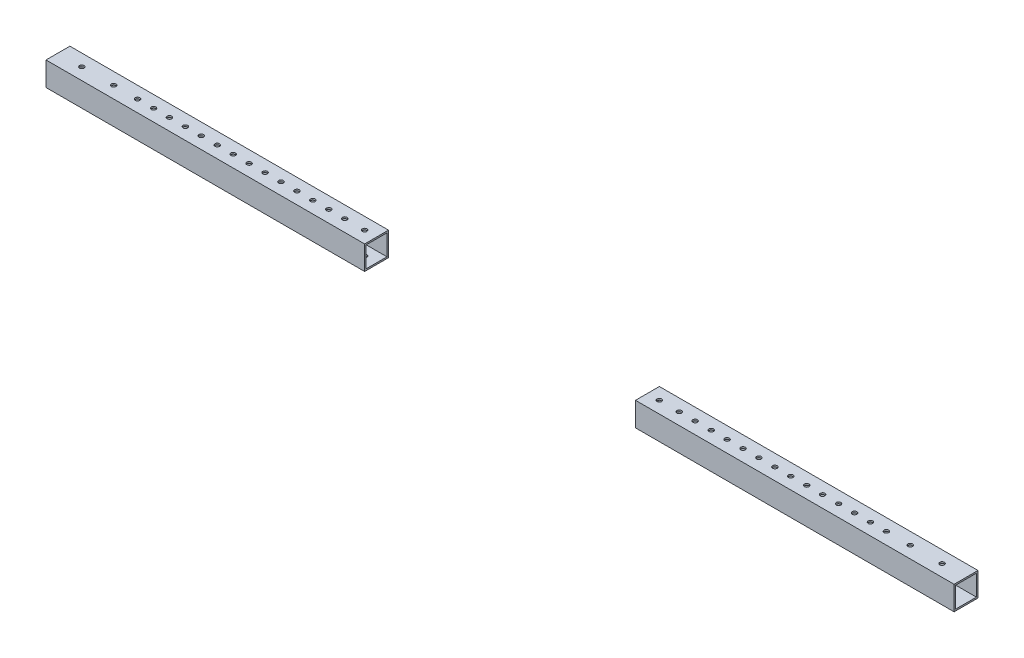
from build123d import *

# Parameters (mm, degrees)
SKETCH_11_W         = 15
SKETCH_11_H         = 15
SKETCH_11_W_2       = 13
SKETCH_11_H_2       = 13
F_15X15X1_1_DEPTH   = 570
SKETCH_12_R         = 1.45
CUT_EXTRUDE_1_DEPTH = 286.49299466
SKETCH_13_R         = 1.45
CUT_EXTRUDE_2_DEPTH = 286.49299466
SKETCH_15_W         = 170
SKETCH_15_H         = 15
CUT_EXTRUDE_4_DEPTH = 286.49299466
SKETCH_16_R         = 1.45
CUT_EXTRUDE_5_DEPTH = 286.49299466


with BuildPart() as part:
    # 草图11 → 铝管 15X15X1(1) (new body)
    with BuildSketch(Plane(origin=(-285, 0, 0), x_dir=(0, 0, -1), z_dir=(1, 0, 0))):
        Rectangle(SKETCH_11_W, SKETCH_11_H)
        Rectangle(SKETCH_11_W_2, SKETCH_11_H_2, mode=Mode.SUBTRACT)
    extrude(amount=F_15X15X1_1_DEPTH)

    # 草图12 → 切除-拉伸1 (cut, through all)
    with BuildSketch(Plane(origin=(0, 7.5, 0), x_dir=(1, 0, 0), z_dir=(0, 1, 0))):
        with Locations(Location((-270, 0, 0), (0, 0, 270))):
            Circle(SKETCH_12_R)
        with Locations(Location((-250, 0, 0), (0, 0, 270))):
            Circle(SKETCH_12_R)
        with Locations(Location((250, 0, 0), (0, 0, 90))):
            Circle(SKETCH_12_R)
        with Locations(Location((270, 0, 0), (0, 0, 90))):
            Circle(SKETCH_12_R)
    extrude(amount=-CUT_EXTRUDE_1_DEPTH, mode=Mode.SUBTRACT)

    # 草图13 → 切除-拉伸2 (cut, through all)
    with BuildSketch(Plane(origin=(0, 0, -7.5), x_dir=(-1, 0, 0), z_dir=(0, 0, -1))):
        with Locations((-18.5, 0)):
            Circle(SKETCH_13_R)
        with Locations((18.5, 0)):
            Circle(SKETCH_13_R)
    extrude(amount=-CUT_EXTRUDE_2_DEPTH, mode=Mode.SUBTRACT)

    # 草图15 → 切除-拉伸4 (cut, through all)
    with BuildSketch(Plane.XZ.offset(7.5)):
        Rectangle(SKETCH_15_W, SKETCH_15_H)
    extrude(amount=-CUT_EXTRUDE_4_DEPTH, mode=Mode.SUBTRACT)


with BuildPart() as cut_extrude_4_piece_1:
    # of the separate pieces the step leaves, piece 1, a body of its own (cut_extrude_4_pieces)
    add(part.part.solids().sort_by_distance((85, -7.5, -7.5))[0])


with BuildPart() as cut_extrude_4_piece_2:
    # of the separate pieces the step leaves, piece 2, a body of its own (cut_extrude_4_pieces)
    add(part.part.solids().sort_by_distance((-285, -7.5, 7.5))[0])


with BuildPart() as cut_extrude_5_tool:
    # 草图16 → 切除-拉伸5 (new, through all)
    with BuildSketch(Plane.XZ.offset(7.5)):
        with Locations(Location((105, 0, 0), (0, 0, 270))):
            Circle(SKETCH_16_R)
        with Locations(Location((115, 0, 0), (0, 0, 270))):
            Circle(SKETCH_16_R)
        with Locations(Location((125, 0, 0), (0, 0, 270))):
            Circle(SKETCH_16_R)
        with Locations(Location((135, 0, 0), (0, 0, 270))):
            Circle(SKETCH_16_R)
        with Locations(Location((145, 0, 0), (0, 0, 270))):
            Circle(SKETCH_16_R)
        with Locations(Location((155, 0, 0), (0, 0, 270))):
            Circle(SKETCH_16_R)
        with Locations(Location((165, 0, 0), (0, 0, 270))):
            Circle(SKETCH_16_R)
        with Locations(Location((175, 0, 0), (0, 0, 270))):
            Circle(SKETCH_16_R)
        with Locations(Location((185, 0, 0), (0, 0, 270))):
            Circle(SKETCH_16_R)
        with Locations(Location((195, 0, 0), (0, 0, 270))):
            Circle(SKETCH_16_R)
        with Locations(Location((205, 0, 0), (0, 0, 270))):
            Circle(SKETCH_16_R)
        with Locations(Location((215, 0, 0), (0, 0, 270))):
            Circle(SKETCH_16_R)
        with Locations(Location((225, 0, 0), (0, 0, 270))):
            Circle(SKETCH_16_R)
        with Locations(Location((235, 0, 0), (0, 0, 270))):
            Circle(SKETCH_16_R)
        with Locations(Location((-235, 0, 0), (0, 0, 90))):
            Circle(SKETCH_16_R)
        with Locations(Location((-225, 0, 0), (0, 0, 90))):
            Circle(SKETCH_16_R)
        with Locations(Location((-215, 0, 0), (0, 0, 90))):
            Circle(SKETCH_16_R)
        with Locations(Location((-205, 0, 0), (0, 0, 90))):
            Circle(SKETCH_16_R)
        with Locations(Location((-195, 0, 0), (0, 0, 90))):
            Circle(SKETCH_16_R)
        with Locations(Location((-185, 0, 0), (0, 0, 90))):
            Circle(SKETCH_16_R)
        with Locations(Location((-175, 0, 0), (0, 0, 90))):
            Circle(SKETCH_16_R)
        with Locations(Location((-165, 0, 0), (0, 0, 90))):
            Circle(SKETCH_16_R)
        with Locations(Location((-155, 0, 0), (0, 0, 90))):
            Circle(SKETCH_16_R)
        with Locations(Location((-145, 0, 0), (0, 0, 90))):
            Circle(SKETCH_16_R)
        with Locations(Location((-135, 0, 0), (0, 0, 90))):
            Circle(SKETCH_16_R)
        with Locations(Location((-125, 0, 0), (0, 0, 90))):
            Circle(SKETCH_16_R)
        with Locations(Location((-115, 0, 0), (0, 0, 90))):
            Circle(SKETCH_16_R)
        with Locations(Location((-105, 0, 0), (0, 0, 90))):
            Circle(SKETCH_16_R)
        with Locations(Location((92.5, 0, 0), (0, 0, 270))):
            Circle(SKETCH_16_R)
        with Locations(Location((-92.5, 0, 0), (0, 0, 90))):
            Circle(SKETCH_16_R)
    extrude(amount=-CUT_EXTRUDE_5_DEPTH)


with BuildPart() as cut_extrude_4_piece_1_1:
    add(cut_extrude_4_piece_1.part)

    # 切除-拉伸5: cut by cut_extrude_5_tool
    add(cut_extrude_5_tool.part, mode=Mode.SUBTRACT)


with BuildPart() as cut_extrude_4_piece_2_1:
    add(cut_extrude_4_piece_2.part)

    # 切除-拉伸5: cut by cut_extrude_5_tool
    add(cut_extrude_5_tool.part, mode=Mode.SUBTRACT)


solid = Compound([cut_extrude_4_piece_1_1.part, cut_extrude_4_piece_2_1.part])
